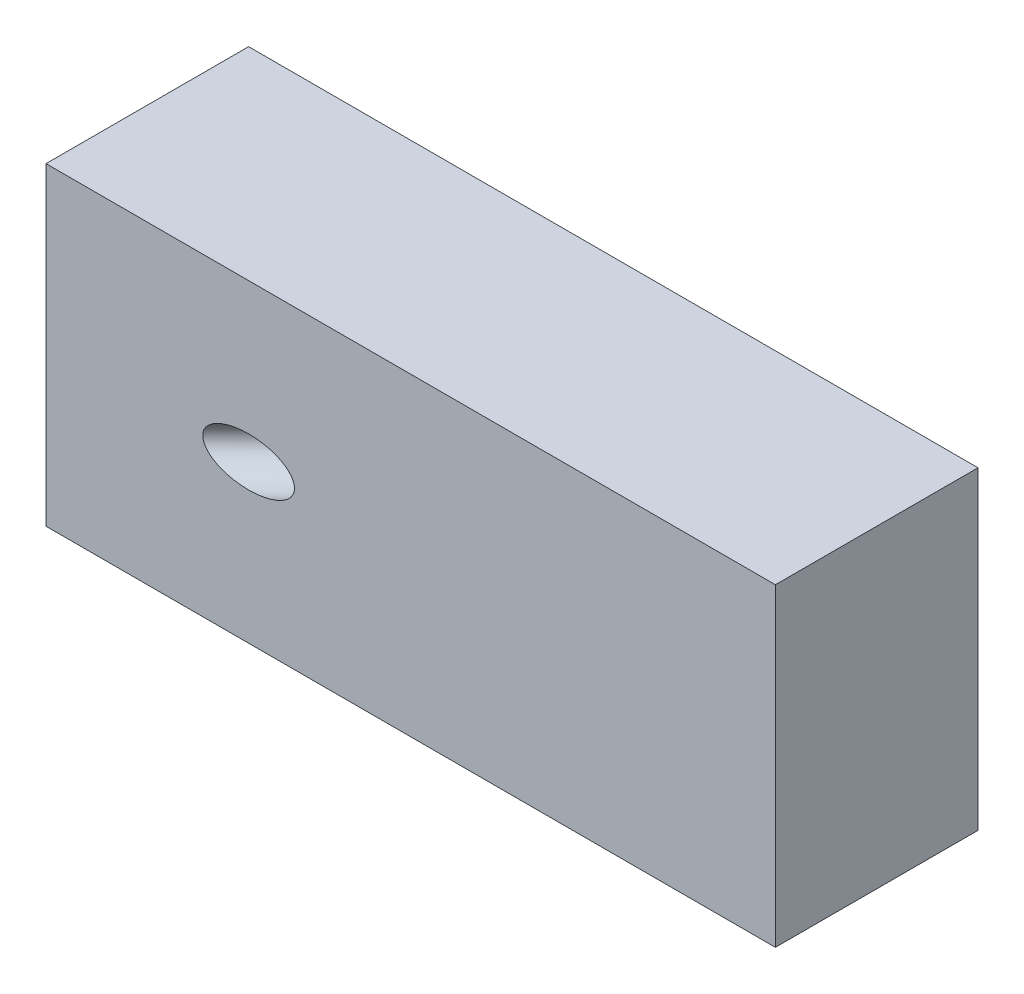
from build123d import *

# Parameters (mm, degrees)
ESQUISSE1_W                  = 18
ESQUISSE1_H                  = 7.75
BOSS_EXTRU_1_DEPTH           = 5
ENL_V_MAT_EXTRU_1_DEPTH      = 15
ENL_V_MAT_EXTRU_1_DEPTH_BACK = 10
ESQUISSE13_RX                = 0.8
ESQUISSE13_RY                = 0.6
ESQUISSE15_R                 = 0.25
BOSS_EXTRU_3_DEPTH           = 0.5


with BuildPart() as part:
    # Esquisse1 → Boss.-Extru.1 (new body)
    with BuildSketch(Plane.XY):
        with Locations((9, 3.875)):
            Rectangle(ESQUISSE1_W, ESQUISSE1_H)
    extrude(amount=BOSS_EXTRU_1_DEPTH)

    # Esquisse13 → Enlèv. mat.-Extru.1 (cut, two sides: drawn at the far end of the back side and taken through both)
    with BuildSketch(Plane(origin=(5, 3.875, 5), x_dir=(-0.7071067811865476, 0, -0.7071067811865475), z_dir=(0.7071067811865475, 0, -0.7071067811865476)).offset(-ENL_V_MAT_EXTRU_1_DEPTH_BACK)):
        with Locations(Location((0, 0), (0, 0, 0))):
            Ellipse(ESQUISSE13_RX, ESQUISSE13_RY)
    extrude(amount=ENL_V_MAT_EXTRU_1_DEPTH + ENL_V_MAT_EXTRU_1_DEPTH_BACK, mode=Mode.SUBTRACT)

    # Esquisse15 → Boss.-Extru.3 (add)
    with BuildSketch(Plane(origin=(0, 0, 0), x_dir=(-1, 0, 0), z_dir=(0, 0, -1))):
        with Locations((-11.729236125, 2.125)):
            Circle(ESQUISSE15_R)
        with Locations((-11.729236125, 5.625)):
            Circle(ESQUISSE15_R)
    extrude(amount=BOSS_EXTRU_3_DEPTH)


solid = part.part
